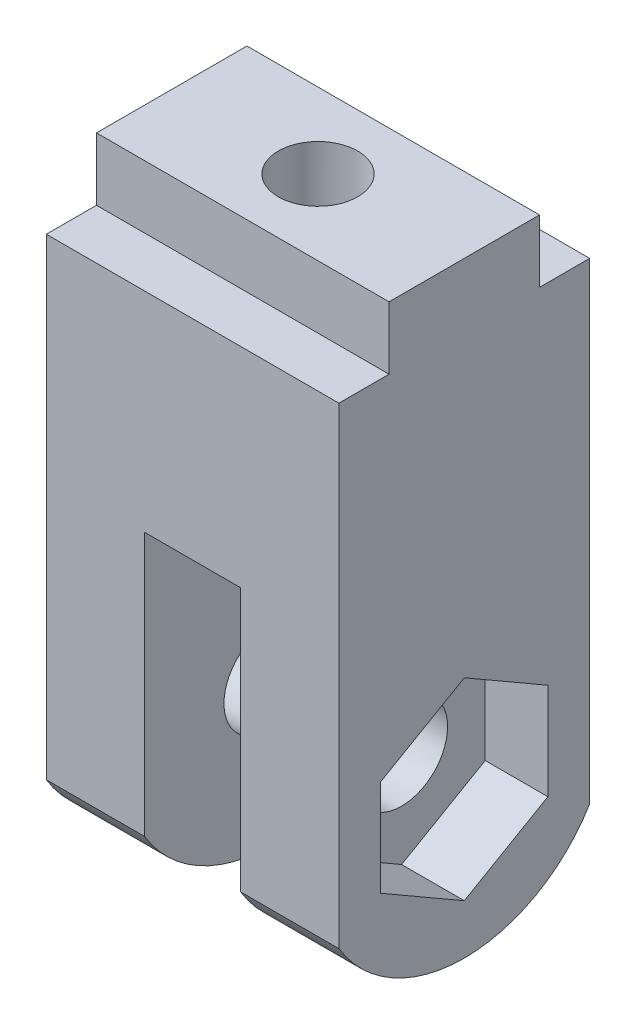
from build123d import *

# Parameters (mm, degrees)
BOSS_EXTRUDE1_DEPTH = 6
SKETCH2_R           = 1.1
CUT_EXTRUDE1_DEPTH  = 28.586228448
CUT_EXTRUDE2_DEPTH  = 1.5
SKETCH4_W           = 7
SKETCH4_H           = 3.6
BOSS_EXTRUDE2_DEPTH = 1.5
SKETCH5_R           = 0.95
CUT_EXTRUDE3_DEPTH  = 6.5


with BuildPart() as part:
    # Sketch1 → Boss-Extrude1 (new body)
    with BuildSketch(Plane.XY):
        Polygon((-1.15, 13), (-1.15, 21), (1.15, 21), (1.15, 13), (3.5, 13), (3.5, 26), (-3.5, 26), (-3.5, 13), align=None)
    extrude(amount=-BOSS_EXTRUDE1_DEPTH)

    # Sketch2 → Cut-Extrude1 (cut, through all)
    with BuildSketch(Plane(origin=(3.5, 0, 0), x_dir=(0, 0, -1), z_dir=(1, 0, 0))):
        with Locations(Location((3, 16.5, 0), (0, 0, 90))):
            Circle(SKETCH2_R)
        with BuildLine():
            ThreePointArc((3.000000016, 13), (1.276589831, 13.453714165), (0, 14.697224362))
            Line((0, 14.697224362), (0, 13))
            Line((0, 13), (3.000000016, 13))
        make_face()
        with BuildLine():
            ThreePointArc((6, 14.697224362), (4.723410183, 13.453714173), (3.000000016, 13))
            Line((3.000000016, 13), (6, 13))
            Line((6, 13), (6, 14.697224362))
        make_face()
    extrude(amount=-CUT_EXTRUDE1_DEPTH, mode=Mode.SUBTRACT)

    # Sketch3 → Cut-Extrude2 (cut)
    with BuildSketch(Plane(origin=(3.5, 0, 0), x_dir=(0, 0, -1), z_dir=(1, 0, 0))):
        Polygon((3, 18.809401077), (1, 17.654700538), (1, 15.345299462), (3, 14.190598923), (5, 15.345299462), (5, 17.654700538), align=None)
    extrude(amount=-CUT_EXTRUDE2_DEPTH, mode=Mode.SUBTRACT)

    # Sketch4 → Boss-Extrude2 (add)
    with BuildSketch(Plane(origin=(0, 26, 0), x_dir=(1, 0, 0), z_dir=(0, 1, 0))):
        with Locations((0, 3)):
            Rectangle(SKETCH4_W, SKETCH4_H)
    extrude(amount=BOSS_EXTRUDE2_DEPTH)

    # Sketch5 → Cut-Extrude3 (cut)
    with BuildSketch(Plane(origin=(0, 27.5, 0), x_dir=(1, 0, 0), z_dir=(0, 1, 0))):
        with Locations(Location((0, 3, 0), (0, 0, 270))):
            Circle(SKETCH5_R)
    extrude(amount=-CUT_EXTRUDE3_DEPTH, mode=Mode.SUBTRACT)


solid = part.part
